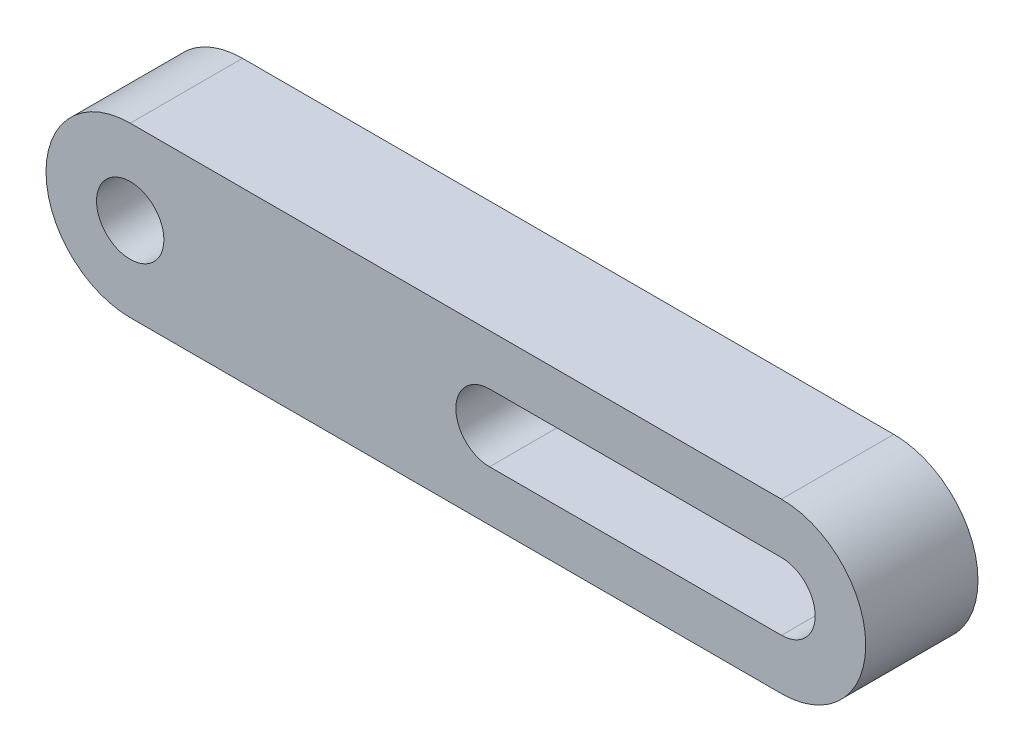
from build123d import *

# Parameters (mm, degrees)
CROQUIS1_R              = 1.5
SALIENTE_EXTRUIR1_DEPTH = 5


with BuildPart() as part:
    # Croquis1 → Saliente-Extruir1 (new body)
    with BuildSketch(Plane.XY):
        with BuildLine():
            Line((0, 3.75), (29, 3.75))
            ThreePointArc((29, 3.75), (32.75, 0), (29, -3.75))
            Line((29, -3.75), (0, -3.75))
            ThreePointArc((0, -3.75), (-3.75, 0), (0, 3.75))
        make_face()
        Circle(CROQUIS1_R, mode=Mode.SUBTRACT)
        with BuildLine():
            Line((29, -1.5), (16, -1.5))
            ThreePointArc((16, -1.5), (14.5, 0), (16, 1.5))
            Line((16, 1.5), (29, 1.5))
            ThreePointArc((29, 1.5), (30.5, 0), (29, -1.5))
        make_face(mode=Mode.SUBTRACT)
    extrude(amount=SALIENTE_EXTRUIR1_DEPTH)


solid = part.part
